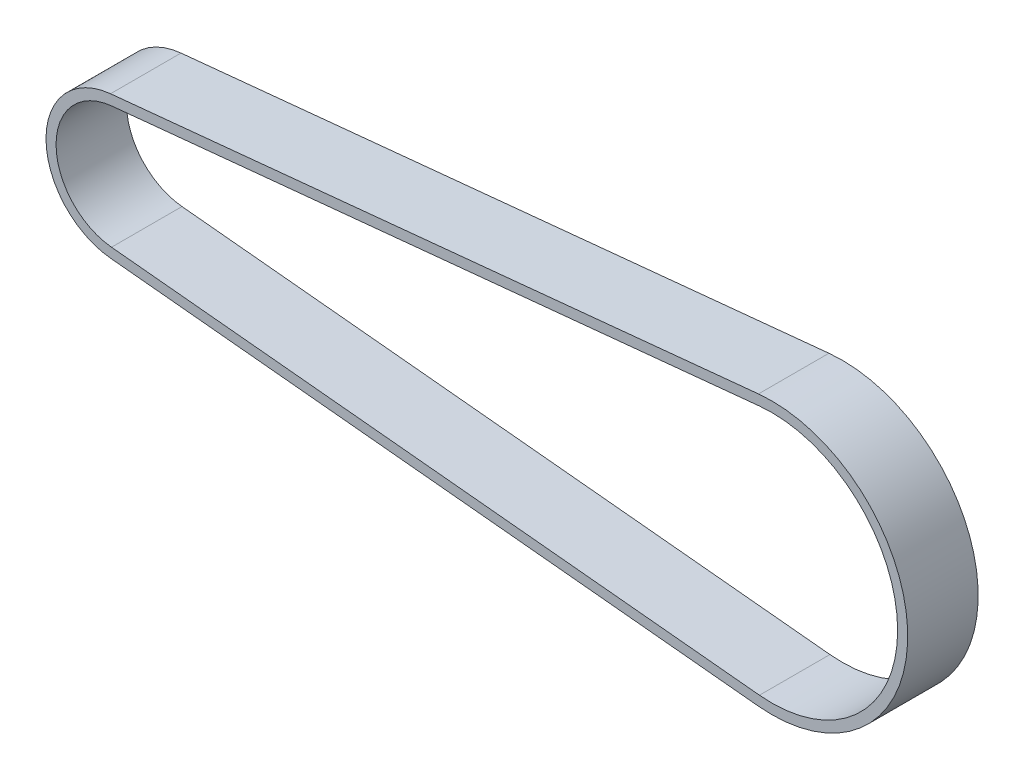
from build123d import *

# Parameters (mm, degrees)
BOSS_EXTRUDE1_DEPTH = 7


with BuildPart() as part:
    # Sketch1 → Boss-Extrude1 (new body)
    with BuildSketch(Plane.XY):
        with BuildLine():
            Line((-0.698967692, 7.075559636), (63.672846154, 13.434606904))
            ThreePointArc((63.672846154, 13.434606904), (78.5, 0), (63.672846154, -13.434606904))
            Line((63.672846154, -13.434606904), (-0.698967692, -7.075559636))
            ThreePointArc((-0.698967692, -7.075559636), (-7.11, 0), (-0.698967692, 7.075559636))
        make_face()
        with BuildLine():
            Line((-0.60066, 6.080403569), (63.771153846, 12.439450837))
            ThreePointArc((63.771153846, 12.439450837), (77.5, 0), (63.771153846, -12.439450837))
            Line((63.771153846, -12.439450837), (-0.60066, -6.080403569))
            ThreePointArc((-0.60066, -6.080403569), (-6.11, 0), (-0.60066, 6.080403569))
        make_face(mode=Mode.SUBTRACT)
    extrude(amount=BOSS_EXTRUDE1_DEPTH)


solid = part.part
